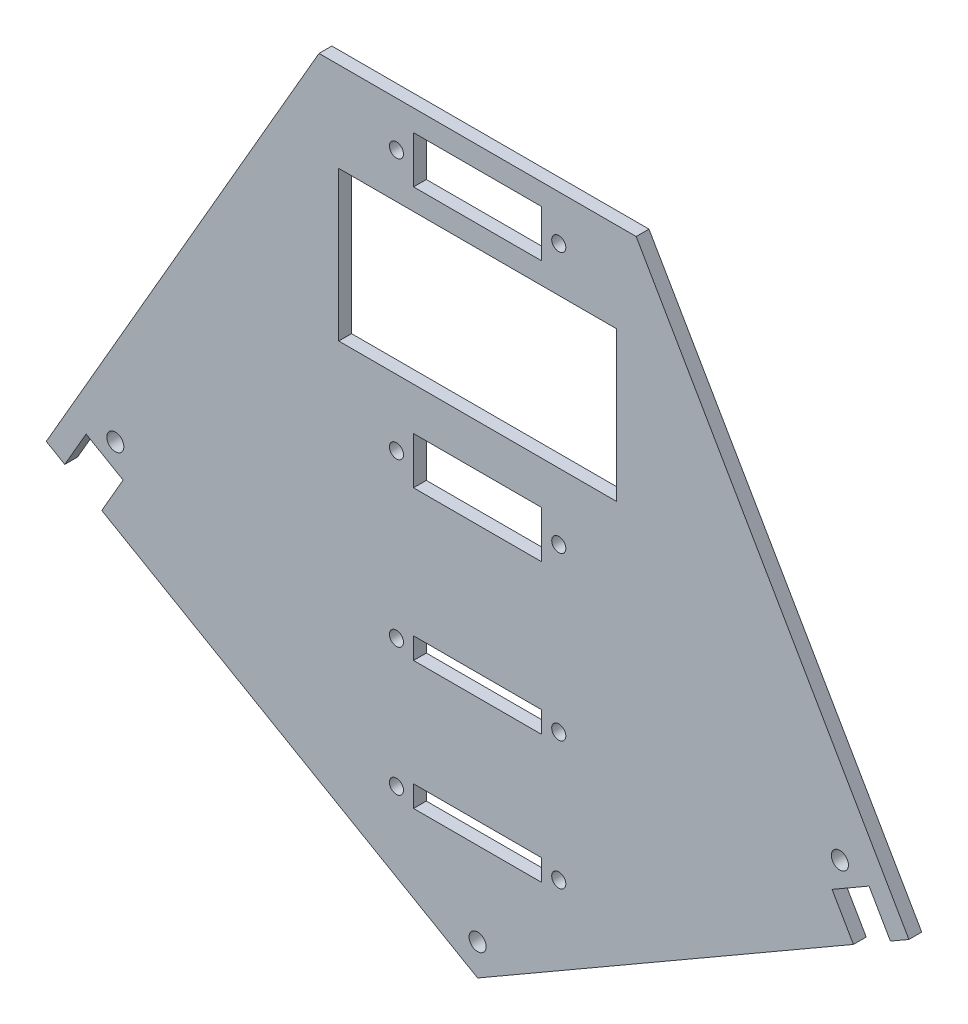
from build123d import *

# Parameters (mm, degrees)
ESQUISSE1_R        = 2
ESQUISSE1_R_2      = 1.65
ESQUISSE1_W        = 65
ESQUISSE1_H        = 35
ESQUISSE1_W_2      = 30
ESQUISSE1_H_2      = 5
ESQUISSE1_H_3      = 11
BOSS_EXTRU_1_DEPTH = 3


with BuildPart() as part:
    # Esquisse1 → Boss.-Extru.1 (new body)
    with BuildSketch(Plane.XY):
        Polygon((37.118802154, 168.871977627), (100.962812921, 58.290907218), (96.632685902, 55.790907218), (91.632685902, 64.451161256), (82.972431864, 59.451161256), (87.972431864, 50.790907218), (0, 0), (-87.972431864, 50.790907218), (-82.972431864, 59.451161256), (-91.632685902, 64.451161256), (-96.632685902, 55.790907218), (-100.962812921, 58.290907218), (-37.118802153, 168.871977627), align=None)
        with Locations((-84.802558883, 66.281288275)):
            Circle(ESQUISSE1_R, mode=Mode.SUBTRACT)
        with Locations((84.802558883, 66.281288275)):
            Circle(ESQUISSE1_R, mode=Mode.SUBTRACT)
        with Locations((-19, 97.371977627)):
            Circle(ESQUISSE1_R_2, mode=Mode.SUBTRACT)
        with Locations((19, 97.371977627)):
            Circle(ESQUISSE1_R_2, mode=Mode.SUBTRACT)
        with Locations((19, 158.371977627)):
            Circle(ESQUISSE1_R_2, mode=Mode.SUBTRACT)
        with Locations((-19, 158.371977627)):
            Circle(ESQUISSE1_R_2, mode=Mode.SUBTRACT)
        with Locations((-19, 59.371977627)):
            Circle(ESQUISSE1_R_2, mode=Mode.SUBTRACT)
        with Locations((0, 7.342924489)):
            Circle(ESQUISSE1_R, mode=Mode.SUBTRACT)
        with Locations((19, 59.371977627)):
            Circle(ESQUISSE1_R_2, mode=Mode.SUBTRACT)
        with Locations((19, 29.371977627)):
            Circle(ESQUISSE1_R_2, mode=Mode.SUBTRACT)
        with Locations((-19, 29.371977627)):
            Circle(ESQUISSE1_R_2, mode=Mode.SUBTRACT)
        with Locations((0, 130.371977627)):
            Rectangle(ESQUISSE1_W, ESQUISSE1_H, mode=Mode.SUBTRACT)
        with Locations((0, 59.371977627)):
            Rectangle(ESQUISSE1_W_2, ESQUISSE1_H_2, mode=Mode.SUBTRACT)
        with Locations((0, 29.371977627)):
            Rectangle(ESQUISSE1_W_2, ESQUISSE1_H_2, mode=Mode.SUBTRACT)
        with Locations((0, 97.371977627)):
            Rectangle(ESQUISSE1_W_2, ESQUISSE1_H_3, mode=Mode.SUBTRACT)
        with Locations((0, 158.371977627)):
            Rectangle(ESQUISSE1_W_2, ESQUISSE1_H_3, mode=Mode.SUBTRACT)
    extrude(amount=BOSS_EXTRU_1_DEPTH)


solid = part.part
